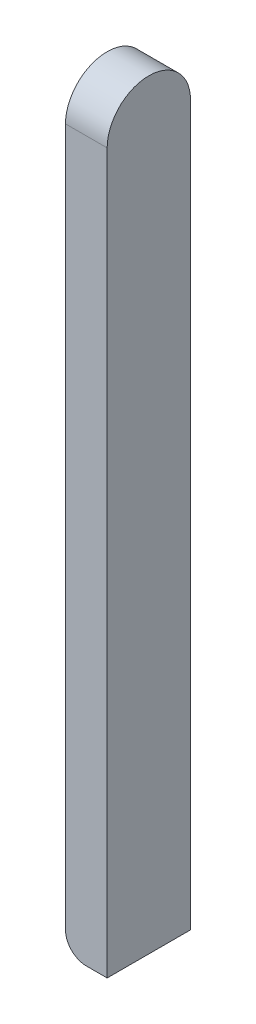
from build123d import *

# Parameters (mm, degrees)
BOSS_EXTRUDE1_DEPTH = 1
FILLET4_R           = 0.5


with BuildPart() as part:
    # Sketch1 → Boss-Extrude1 (new body)
    with BuildSketch(Plane(origin=(0, 0, 0), x_dir=(0, 0, -1), z_dir=(1, 0, 0))):
        with BuildLine():
            Line((-1, 8.125), (-1, -9.125))
            Line((-1, -9.125), (1, -9.125))
            Line((1, -9.125), (1, 8.125))
            ThreePointArc((1, 8.125), (0, 9.125), (-1, 8.125))
        make_face()
    extrude(amount=BOSS_EXTRUDE1_DEPTH)

    # Fillet4
    fillet4_edges = [part.edges().sort_by_distance(p)[0] for p in [
        (0, -9.125, 0),
    ]]
    fillet(fillet4_edges, radius=FILLET4_R)


solid = part.part
